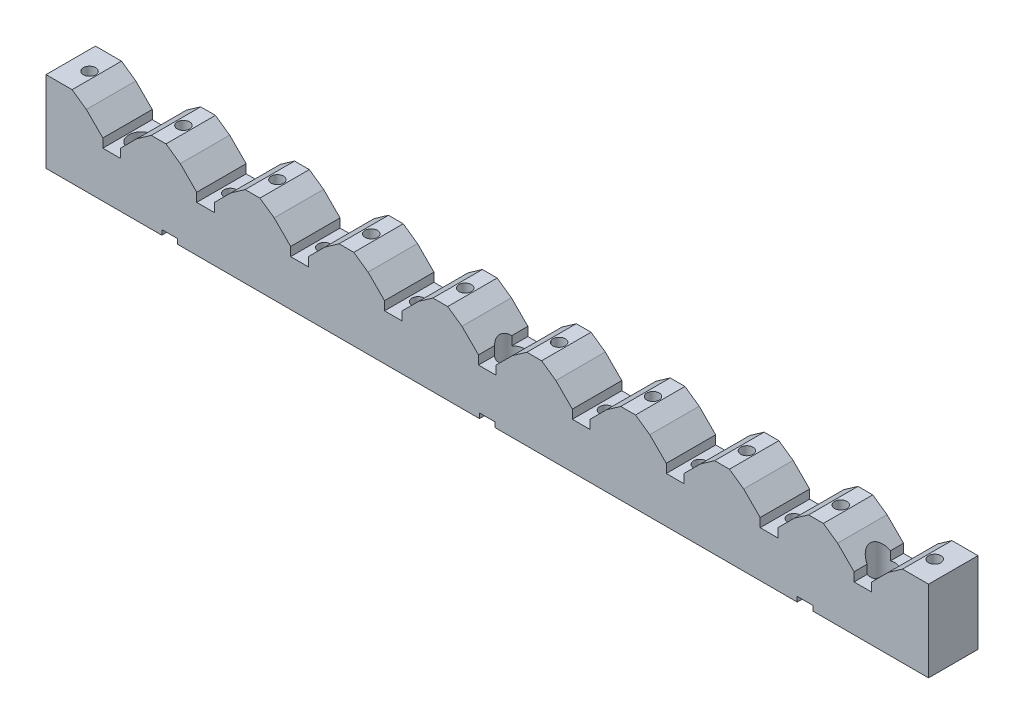
from build123d import *

# Parameters (mm, degrees)
SKETCH1_W                                = 1250
SKETCH1_H                                = 115
BOSS_EXTRUDE1_DEPTH                      = 35
CUT_EXTRUDE1_DEPTH                       = 70
CUT_EXTRUDE3_START                       = -70
SKETCH9_W                                = 25
SKETCH9_H                                = 38.657600419
CUT_EXTRUDE3_DEPTH                       = 70
LPATTERN1_COUNT                          = 9
LPATTERN1_PITCH                          = 133
LPATTERN2_COUNT                          = 9
LPATTERN2_PITCH                          = 133
LPATTERN2_COL_COUNT                      = 2
LPATTERN2_COL_PITCH                      = 133
LPATTERN3_COUNT                          = 7
LPATTERN3_PITCH                          = 133
CUT_EXTRUDE2_DEPTH                       = 7
M8_TAPPED_HOLE1_AT_2_COUNT               = 2
M8_TAPPED_HOLE1_AT_2_PITCH               = 66
CBORE_FOR_M20_HEX_HEAD_BOLT1_D           = 22
CBORE_FOR_M20_HEX_HEAD_BOLT1_CBORE_D     = 35
CBORE_FOR_M20_HEX_HEAD_BOLT1_CBORE_DEPTH = 72
LPATTERN4_COUNT                          = 3
LPATTERN4_PITCH                          = 525
SKETCH14_W                               = 22
SKETCH14_H                               = 70
CUT_EXTRUDE4_DEPTH                       = 7


with BuildPart() as part:
    # Sketch1 → Boss-Extrude1 (new, symmetric)
    with BuildSketch(Plane.XY):
        with Locations((0, 57.5)):
            Rectangle(SKETCH1_W, SKETCH1_H)
    extrude(amount=BOSS_EXTRUDE1_DEPTH, both=True)

    # Sketch2 → Cut-Extrude1 (cut)
    with BuildSketch(Plane.XY.offset(35)):
        Polygon((-475.945987185, 115), (-588.054012815, 115), (-567.86, 100.86), (-542, 75), (-542, 65), (-522, 65), (-522, 75), (-496.14, 100.86), align=None)
    cut_extrude1 = extrude(amount=-CUT_EXTRUDE1_DEPTH, mode=Mode.SUBTRACT)

    # Sketch9 → Cut-Extrude3 (cut)
    with BuildSketch(Plane.XY.offset(35).offset(CUT_EXTRUDE3_START)):
        with Locations((-532, 84.32880021)):
            Rectangle(SKETCH9_W, SKETCH9_H)
    cut_extrude3 = extrude(amount=CUT_EXTRUDE3_DEPTH, mode=Mode.SUBTRACT)

    # Sketch4 → M20 Tapped Hole1 (revolve, cut)
    with BuildSketch(Plane(origin=(-465.330987185, 115, 0), x_dir=(0, 0, 1), z_dir=(1, 0, 0))):
        Polygon((0, 0), (0, 45.257530416), (8.75, 40), (8.75, 0), align=None)
    m20_tapped_hole1 = revolve(axis=Axis((-465.330987185, 121.35, 0), (0, -1, 0)), mode=Mode.SUBTRACT)

    # LPattern1: Cut-Extrude1, Cut-Extrude3 ×9
    with Locations(*[(i * LPATTERN1_PITCH, 0, 0) for i in range(1, LPATTERN1_COUNT)]):
        add(cut_extrude1, mode=Mode.SUBTRACT)
        add(cut_extrude3, mode=Mode.SUBTRACT)

    # LPattern2: M20 Tapped Hole1 ×9
    with Locations(*[(i * LPATTERN2_PITCH, 0, 0) for i in range(1, LPATTERN2_COUNT)]):
        add(m20_tapped_hole1, mode=Mode.SUBTRACT)

    # LPattern2 col: M20 Tapped Hole1 ×2
    with Locations(*[(-i * LPATTERN2_COL_PITCH, 0, 0) for i in range(1, LPATTERN2_COL_COUNT)]):
        add(m20_tapped_hole1, mode=Mode.SUBTRACT)

    # Sketch7 → M20 Tapped Hole2 (revolve, cut)
    with BuildSketch(Plane(origin=(-399, 65, 0), x_dir=(0, 0, 1), z_dir=(1, 0, 0))):
        Polygon((0, 0), (0, 45.257530416), (8.75, 40), (8.75, 0), align=None)
    m20_tapped_hole2 = revolve(axis=Axis((-399, 71.35, 0), (0, -1, 0)), mode=Mode.SUBTRACT)

    # LPattern3: M20 Tapped Hole2 ×7, 1 skipped
    with Locations(*[(i * LPATTERN3_PITCH, 0, 0) for i in range(1, LPATTERN3_COUNT) if i not in (3,)]):
        add(m20_tapped_hole2, mode=Mode.SUBTRACT)

    # Sketch8 → Cut-Extrude2 (cut)
    with BuildSketch(Plane.XZ):
        with BuildLine():
            Line((-461, 35), (-439, 35))
            Line((-439, 35), (-439, 11))
            Line((-439, 11), (-350, 11))
            ThreePointArc((-350, 11), (-339, 0), (-350, -11))
            Line((-350, -11), (-439, -11))
            Line((-439, -11), (-439, -35))
            Line((-439, -35), (-461, -35))
            Line((-461, -35), (-461, 35))
        make_face()
    cut_extrude2 = extrude(amount=-CUT_EXTRUDE2_DEPTH, mode=Mode.SUBTRACT)

    # Sketch13 → M8 Tapped Hole1 (revolve, cut)
    with BuildSketch(Plane(origin=(-450, 7, 0), x_dir=(0, 0, -1), z_dir=(1, 0, 0))):
        Polygon((0, 0), (0, 22.042926105), (3.4, 20), (3.4, 0), align=None)
    m8_tapped_hole1 = revolve(axis=Axis((-450, 0.65, 0), (0, 1, 0)), mode=Mode.SUBTRACT)

    # M8 Tapped Hole1 at 2: M8 Tapped Hole1 ×2
    with Locations(*[(i * M8_TAPPED_HOLE1_AT_2_PITCH, 0, 0) for i in range(1, M8_TAPPED_HOLE1_AT_2_COUNT)]):
        add(m8_tapped_hole1, mode=Mode.SUBTRACT)

    # Mirror1: Cut-Extrude2, M8 Tapped Hole1 across plane
    add(cut_extrude2.mirror(Plane(origin=(0, 0, 0), x_dir=(0, 0, 1), z_dir=(1, 0, 0))), mode=Mode.SUBTRACT)
    add(m8_tapped_hole1.mirror(Plane(origin=(0, 0, 0), x_dir=(0, 0, 1), z_dir=(1, 0, 0))), mode=Mode.SUBTRACT)

    # Mirror1 copy 1 sketch → Mirror1 copy 1 (revolve, cut)
    with BuildSketch(Plane(origin=(384, 7, 0), x_dir=(0, 0, -1), z_dir=(-1, 0, 0))):
        Polygon((0, 0), (0, -22.042926105), (3.4, -20), (3.4, 0), align=None)
    revolve(axis=Axis((384, 0.65, 0), (0, -1, 0)), mode=Mode.SUBTRACT)

    # CBORE for M20 Hex Head Bolt1 (through all)
    with Locations(Plane(origin=(0, 115, 0), x_dir=(1, 0, 0), z_dir=(0, 1, 0))):
        with Locations((-525, 0)):
            cbore_for_m20_hex_head_bolt1 = CounterBoreHole(CBORE_FOR_M20_HEX_HEAD_BOLT1_D / 2, CBORE_FOR_M20_HEX_HEAD_BOLT1_CBORE_D / 2, CBORE_FOR_M20_HEX_HEAD_BOLT1_CBORE_DEPTH)

    # LPattern4: CBORE for M20 Hex Head Bolt1 ×3
    with Locations(*[(i * LPATTERN4_PITCH, 0, 0) for i in range(1, LPATTERN4_COUNT)]):
        add(cbore_for_m20_hex_head_bolt1, mode=Mode.SUBTRACT)

    # Sketch14 → Cut-Extrude4 (cut)
    with BuildSketch(Plane.XZ):
        Rectangle(SKETCH14_W, SKETCH14_H)
    extrude(amount=-CUT_EXTRUDE4_DEPTH, mode=Mode.SUBTRACT)


solid = part.part
